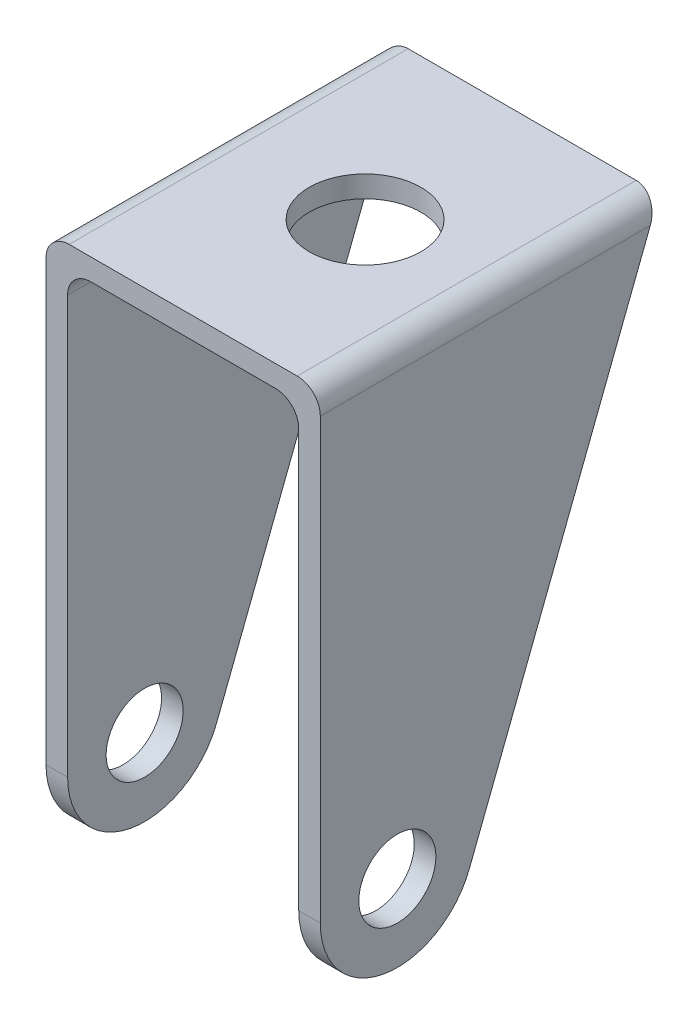
from build123d import *

# Parameters (mm, degrees)
EXTRUDE_THIN1_DEPTH = 44
SKETCH3_OUTSIDE_W   = 64.442
SKETCH3_OUTSIDE_H   = 93.242
CUT_EXTRUDE1_DEPTH  = 93.212797377
SKETCH4_R           = 5
CUT_EXTRUDE2_DEPTH  = 93.212797377
SKETCH5_R           = 7.25
CUT_EXTRUDE3_DEPTH  = 10
FILLET3_R           = 3


with BuildPart() as part:
    # Sketch1 → Extrude-Thin1 (new body)
    with BuildSketch(Plane.XY):
        Polygon((0, 0), (0, 70), (30, 70), (30, 0), (32.8, 0), (32.8, 72.8), (-2.8, 72.8), (-2.8, 0), align=None)
    extrude(amount=EXTRUDE_THIN1_DEPTH)

    # Sketch3 outside → Cut-Extrude1 (cut, through all)
    with BuildSketch(Plane(origin=(32.8, 0, 0), x_dir=(0, 0, -1), z_dir=(1, 0, 0))):
        with Locations((-22, 36.4)):
            Rectangle(SKETCH3_OUTSIDE_W, SKETCH3_OUTSIDE_H)
        with BuildLine():
            Line((-44, 12.8), (-44, 72.8))
            Line((-44, 72.8), (0, 72.8))
            Line((0, 72.8), (-24.676843343, 9.183544561))
            ThreePointArc((-24.676843343, 9.183544561), (-35.839624069, 2.9706672), (-44, 12.8))
        make_face(mode=Mode.SUBTRACT)
    extrude(amount=-CUT_EXTRUDE1_DEPTH, mode=Mode.SUBTRACT)

    # Sketch4 → Cut-Extrude2 (cut, through all)
    with BuildSketch(Plane.ZY.offset(2.8)):
        with Locations((34, 12.8)):
            Circle(SKETCH4_R)
    extrude(amount=-CUT_EXTRUDE2_DEPTH, mode=Mode.SUBTRACT)

    # Sketch5 → Cut-Extrude3 (cut)
    with BuildSketch(Plane(origin=(0, 72.8, 0), x_dir=(1, 0, 0), z_dir=(0, 1, 0))):
        with Locations(Location((16.61, -22, 0), (0, 0, 270))):
            Circle(SKETCH5_R)
    extrude(amount=-CUT_EXTRUDE3_DEPTH, mode=Mode.SUBTRACT)

    # Fillet3
    fillet3_edges = [part.edges().sort_by_distance(p)[0] for p in [
        (30, 70, 22.543060446),
        (0, 70, 22.543060446),
        (-2.8, 72.8, 22),
        (32.8, 72.8, 22),
    ]]
    fillet(fillet3_edges, radius=FILLET3_R)


solid = part.part
